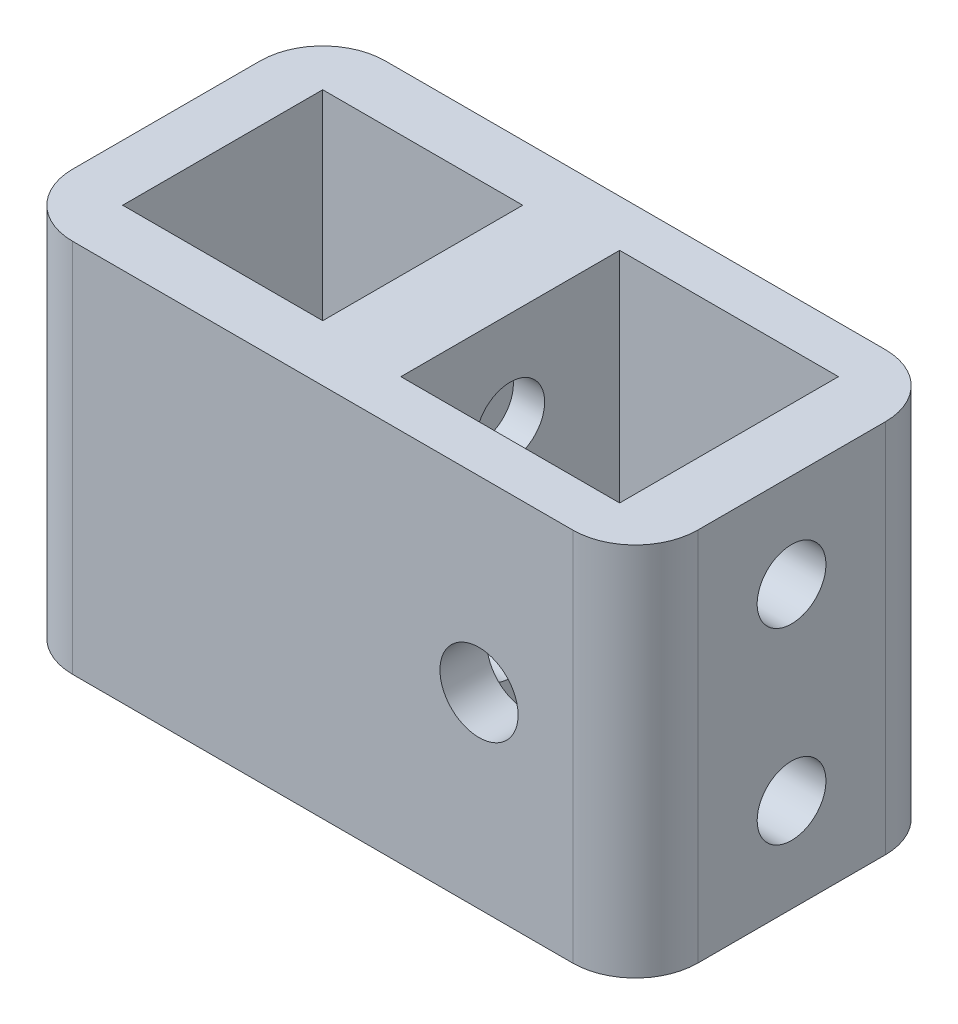
from build123d import *

# Parameters (mm, degrees)
SKETCH2_W           = 10
SKETCH2_H           = 10
SKETCH2_R           = 2
BOSS_EXTRUDE1_DEPTH = 4
SKETCH2_3_W         = 10
SKETCH2_3_H         = 10
SKETCH2_3_W_2       = 6.4
SKETCH2_3_H_2       = 6.4
BOSS_EXTRUDE2_DEPTH = 12
SKETCH2_4_W         = 10
SKETCH2_4_H         = 10
BOSS_EXTRUDE3_DEPTH = 12
SKETCH3_R           = 1.25
CUT_EXTRUDE1_DEPTH  = 12
SKETCH4_R           = 1.1
CUT_EXTRUDE2_DEPTH  = 10
FILLET1_R           = 2
SKETCH5_W           = 7
SKETCH5_H           = 7
CUT_EXTRUDE3_DEPTH  = 14


with BuildPart() as part:
    # Sketch2 → Boss-Extrude1 (new body)
    with BuildSketch(Plane(origin=(0, 0, 0), x_dir=(1, 0, 0), z_dir=(0, 1, 0))):
        Rectangle(SKETCH2_W, SKETCH2_H)
        Circle(SKETCH2_R, mode=Mode.SUBTRACT)
    extrude(amount=BOSS_EXTRUDE1_DEPTH)

    # Sketch2<3> → Boss-Extrude2 (add)
    with BuildSketch(Plane(origin=(0, 0, 0), x_dir=(1, 0, 0), z_dir=(0, 1, 0))):
        Rectangle(SKETCH2_3_W, SKETCH2_3_H)
        Rectangle(SKETCH2_3_W_2, SKETCH2_3_H_2, mode=Mode.SUBTRACT)
    extrude(amount=BOSS_EXTRUDE2_DEPTH)

    # Sketch2<4> → Boss-Extrude3 (add)
    with BuildSketch(Plane(origin=(0, 0, 0), x_dir=(1, 0, 0), z_dir=(0, 1, 0))):
        with Locations((10, 0)):
            Rectangle(SKETCH2_4_W, SKETCH2_4_H)
    extrude(amount=BOSS_EXTRUDE3_DEPTH)

    # Sketch3 → Cut-Extrude1 (cut)
    with BuildSketch(Plane.XY.offset(5)):
        with Locations((10, 6)):
            Circle(SKETCH3_R)
    extrude(amount=-CUT_EXTRUDE1_DEPTH, mode=Mode.SUBTRACT)

    # Sketch4 → Cut-Extrude2 (cut)
    with BuildSketch(Plane(origin=(15, 0, 0), x_dir=(0, 0, -1), z_dir=(1, 0, 0))):
        with Locations((0, 9)):
            Circle(SKETCH4_R)
        with Locations((0, 3)):
            Circle(SKETCH4_R)
    extrude(amount=-CUT_EXTRUDE2_DEPTH, mode=Mode.SUBTRACT)

    # Fillet1
    fillet1_edges = [part.edges().sort_by_distance(p)[0] for p in [
        (-5, 6, 5),
        (-5, 6, -5),
        (15, 6, -5),
        (15, 6, 5),
    ]]
    fillet(fillet1_edges, radius=FILLET1_R)

    # Sketch5 → Cut-Extrude3 (cut)
    with BuildSketch(Plane(origin=(0, 12, 0), x_dir=(1, 0, 0), z_dir=(0, 1, 0))):
        with Locations((9.5, 0)):
            Rectangle(SKETCH5_W, SKETCH5_H)
    extrude(amount=-CUT_EXTRUDE3_DEPTH, mode=Mode.SUBTRACT)


solid = part.part
